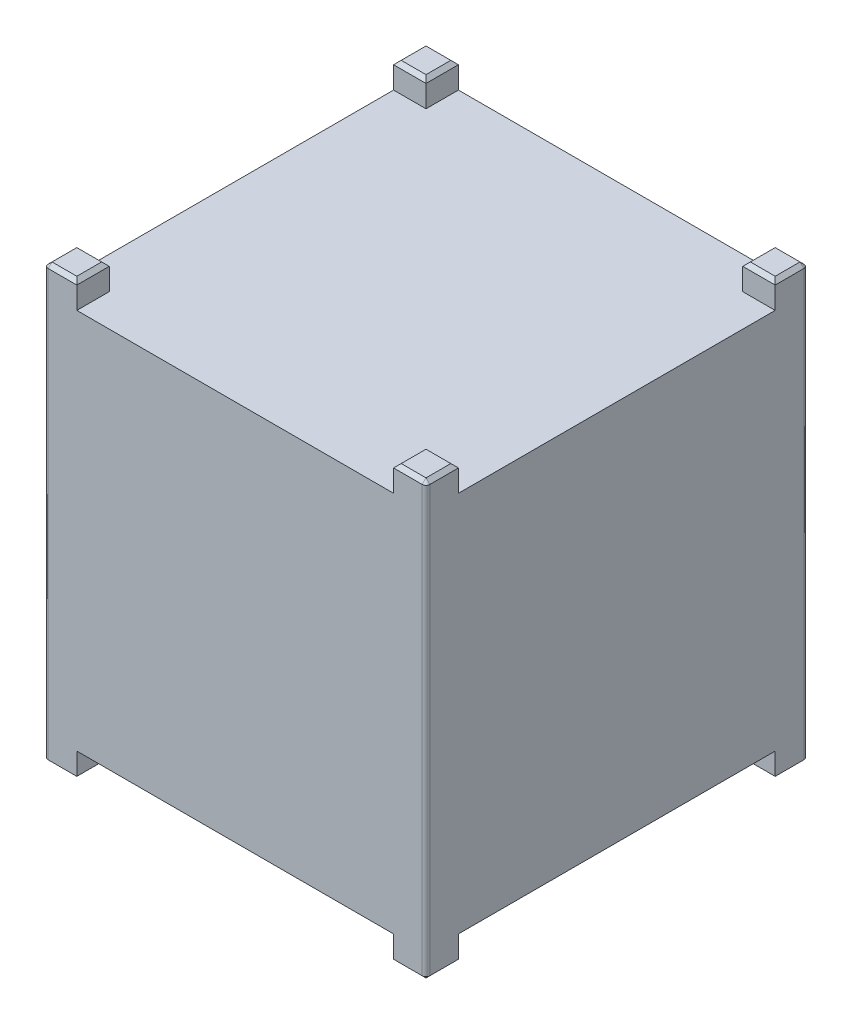
from build123d import *

# Parameters (mm, degrees)
PERIMETER_DEPTH      = 50
PERIMETER_DEPTH_BACK = 50
PERIMETER_SKETCH_W   = 100
PERIMETER_SKETCH_H   = 100
RAILS_DEPTH          = 56.75
RAILS_DEPTH_BACK     = 56.75
RAIL_SKETCH_W        = 8.5
RAIL_SKETCH_H        = 8.5
FILLET1_R            = 1
CHAMFER1_SIZE        = 1


with BuildPart() as part:
    # CG SKETCH → CENTER OF GRAVITY (revolve)
    with BuildSketch(Plane(origin=(0, 0, 0), x_dir=(1, 0, 0), z_dir=(0, 1, 0))):
        with BuildLine():
            Line((0, -20), (0, 20))
            ThreePointArc((0, 20), (-20, 0), (0, -20))
        make_face()
    revolve(axis=Axis((0, 0, -80.9), (0, 0, 1)))


with BuildPart() as body_2:
    # PERIMETER SKETCH → PERIMETER (new, two sides: drawn at the far end of the back side and taken through both)
    with BuildSketch(Plane(origin=(0, 0, 0), x_dir=(1, 0, 0), z_dir=(0, 1, 0)).offset(-PERIMETER_DEPTH_BACK)):
        Rectangle(PERIMETER_SKETCH_W, PERIMETER_SKETCH_H)
    extrude(amount=PERIMETER_DEPTH + PERIMETER_DEPTH_BACK)

    # RAIL SKETCH → RAILS (add, two sides: drawn at the far end of the back side and taken through both)
    with BuildSketch(Plane(origin=(0, 0, 0), x_dir=(1, 0, 0), z_dir=(0, 1, 0)).offset(-RAILS_DEPTH_BACK)):
        with Locations((-45.75, 45.75)):
            Rectangle(RAIL_SKETCH_W, RAIL_SKETCH_H)
        with Locations((45.75, 45.75)):
            Rectangle(RAIL_SKETCH_W, RAIL_SKETCH_H)
        with Locations((-45.75, -45.75)):
            Rectangle(RAIL_SKETCH_W, RAIL_SKETCH_H)
        with Locations((45.75, -45.75)):
            Rectangle(RAIL_SKETCH_W, RAIL_SKETCH_H)
    extrude(amount=RAILS_DEPTH + RAILS_DEPTH_BACK)

    # Fillet1
    fillet1_edges = [body_2.edges().sort_by_distance(p)[0] for p in [
        (-50, 0, -50),
        (50, 0, -50),
        (50, 0, 50),
        (-50, 0, 50),
    ]]
    fillet(fillet1_edges, radius=FILLET1_R)

    # Chamfer1
    chamfer1_edges = [body_2.edges().sort_by_distance(p)[0] for p in [
        (-45.25, -56.75, 50),
        (-41.5, -56.75, 45.75),
        (-45.75, -56.75, 41.5),
        (-50, -56.75, 45.25),
        (45.75, -56.75, 41.5),
        (41.5, -56.75, 45.75),
        (45.25, -56.75, 50),
        (50, -56.75, 45.25),
        (-45.75, -56.75, -41.5),
        (-41.5, -56.75, -45.75),
        (-45.25, -56.75, -50),
        (-50, -56.75, -45.25),
        (45.25, -56.75, -50),
        (41.5, -56.75, -45.75),
        (45.75, -56.75, -41.5),
        (50, -56.75, -45.25),
        (45.25, 56.75, 50),
        (41.5, 56.75, 45.75),
        (45.75, 56.75, 41.5),
        (50, 56.75, 45.25),
        (-45.75, 56.75, 41.5),
        (-41.5, 56.75, 45.75),
        (-45.25, 56.75, 50),
        (-50, 56.75, 45.25),
        (45.75, 56.75, -41.5),
        (41.5, 56.75, -45.75),
        (45.25, 56.75, -50),
        (50, 56.75, -45.25),
        (-45.25, 56.75, -50),
        (-41.5, 56.75, -45.75),
        (-45.75, 56.75, -41.5),
        (-50, 56.75, -45.25),
        (-49.707106781, -56.75, 49.707106781),
        (49.707106781, -56.75, 49.707106781),
        (-49.707106781, -56.75, -49.707106781),
        (49.707106781, -56.75, -49.707106781),
        (49.707106781, 56.75, 49.707106781),
        (-49.707106781, 56.75, 49.707106781),
        (49.707106781, 56.75, -49.707106781),
        (-49.707106781, 56.75, -49.707106781),
    ]]
    chamfer(chamfer1_edges, length=CHAMFER1_SIZE)


solid = Compound([part.part, body_2.part])
